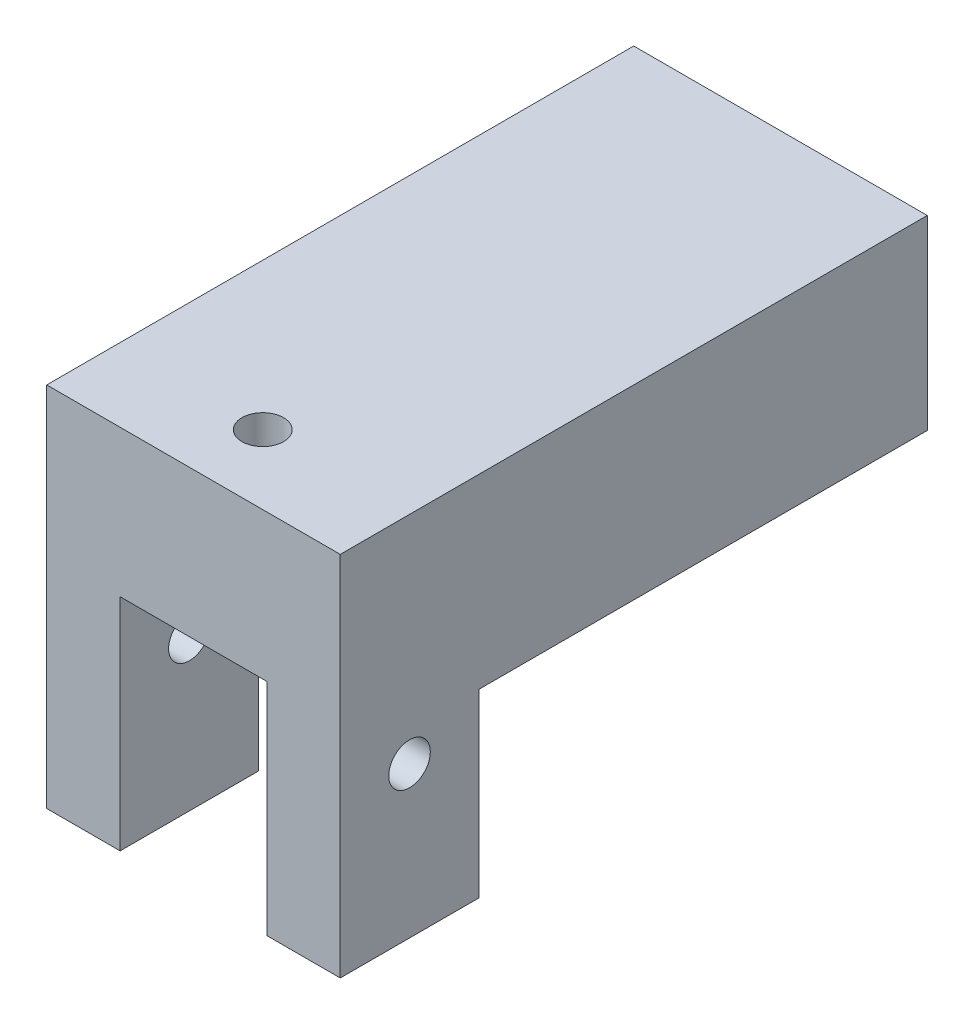
from build123d import *

# Parameters (mm, degrees)
BOSS_EXTRUDE1_DEPTH  = 25.4
SKETCH2_W            = 12.7
SKETCH2_H            = 19.05
CUT_EXTRUDE1_DEPTH   = 11.9888
M3_CLEARANCE_HOLE1_D = 3.6
M3_CLEARANCE_HOLE2_D = 3.6


with BuildPart() as part:
    # Sketch1 → Boss-Extrude1 (new body)
    with BuildSketch(Plane(origin=(0, 0, 0), x_dir=(0, 0, -1), z_dir=(1, 0, 0))):
        Polygon((0, 0), (0, 31.75), (50.8, 31.75), (50.8, 15.6337), (11.9888, 15.6337), (11.9888, 0), align=None)
    extrude(amount=BOSS_EXTRUDE1_DEPTH)

    # Sketch2 → Cut-Extrude1 (cut)
    with BuildSketch(Plane.XY):
        with Locations((12.7, 9.525)):
            Rectangle(SKETCH2_W, SKETCH2_H)
    extrude(amount=-CUT_EXTRUDE1_DEPTH, mode=Mode.SUBTRACT)

    # M3 Clearance Hole1 (through all)
    with Locations(Plane(origin=(25.4, 0, 0), x_dir=(0, 0, -1), z_dir=(1, 0, 0))):
        with Locations((5.9944, 13.0556)):
            Hole(M3_CLEARANCE_HOLE1_D / 2)

    # M3 Clearance Hole2 (through all)
    with Locations(Plane(origin=(0, 31.75, 0), x_dir=(1, 0, 0), z_dir=(0, 1, 0))):
        with Locations((12.7, 5.9944)):
            Hole(M3_CLEARANCE_HOLE2_D / 2)


solid = part.part
